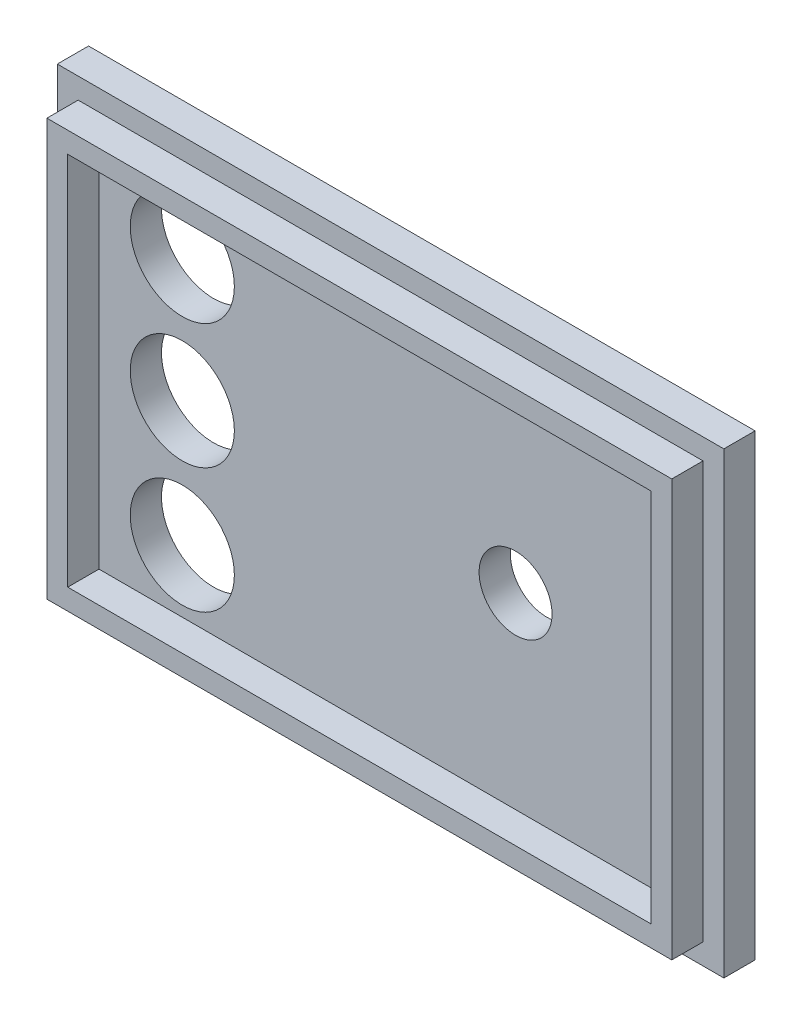
from build123d import *

# Parameters (mm, degrees)
CROQUIS1_W              = 64
CROQUIS1_H              = 44
CROQUIS1_R              = 5
CROQUIS1_R_2            = 3.5
SALIENTE_EXTRUIR1_DEPTH = 3
CROQUIS3_W              = 60
CROQUIS3_H              = 40
CROQUIS3_W_2            = 56
CROQUIS3_H_2            = 36
SALIENTE_EXTRUIR2_DEPTH = 3


with BuildPart() as part:
    # Croquis1 → Saliente-Extruir1 (new body)
    with BuildSketch(Plane.XY):
        with Locations((-32, 22)):
            Rectangle(CROQUIS1_W, CROQUIS1_H)
        with Locations((-52, 34)):
            Circle(CROQUIS1_R, mode=Mode.SUBTRACT)
        with Locations((-52, 10)):
            Circle(CROQUIS1_R, mode=Mode.SUBTRACT)
        with Locations((-20, 22)):
            Circle(CROQUIS1_R_2, mode=Mode.SUBTRACT)
        with Locations((-52, 22)):
            Circle(CROQUIS1_R, mode=Mode.SUBTRACT)
    extrude(amount=SALIENTE_EXTRUIR1_DEPTH)

    # Croquis3 → Saliente-Extruir2 (add)
    with BuildSketch(Plane.XY.offset(3)):
        with Locations((-32, 22)):
            Rectangle(CROQUIS3_W, CROQUIS3_H)
        with Locations((-32, 22)):
            Rectangle(CROQUIS3_W_2, CROQUIS3_H_2, mode=Mode.SUBTRACT)
    extrude(amount=SALIENTE_EXTRUIR2_DEPTH)


solid = part.part
